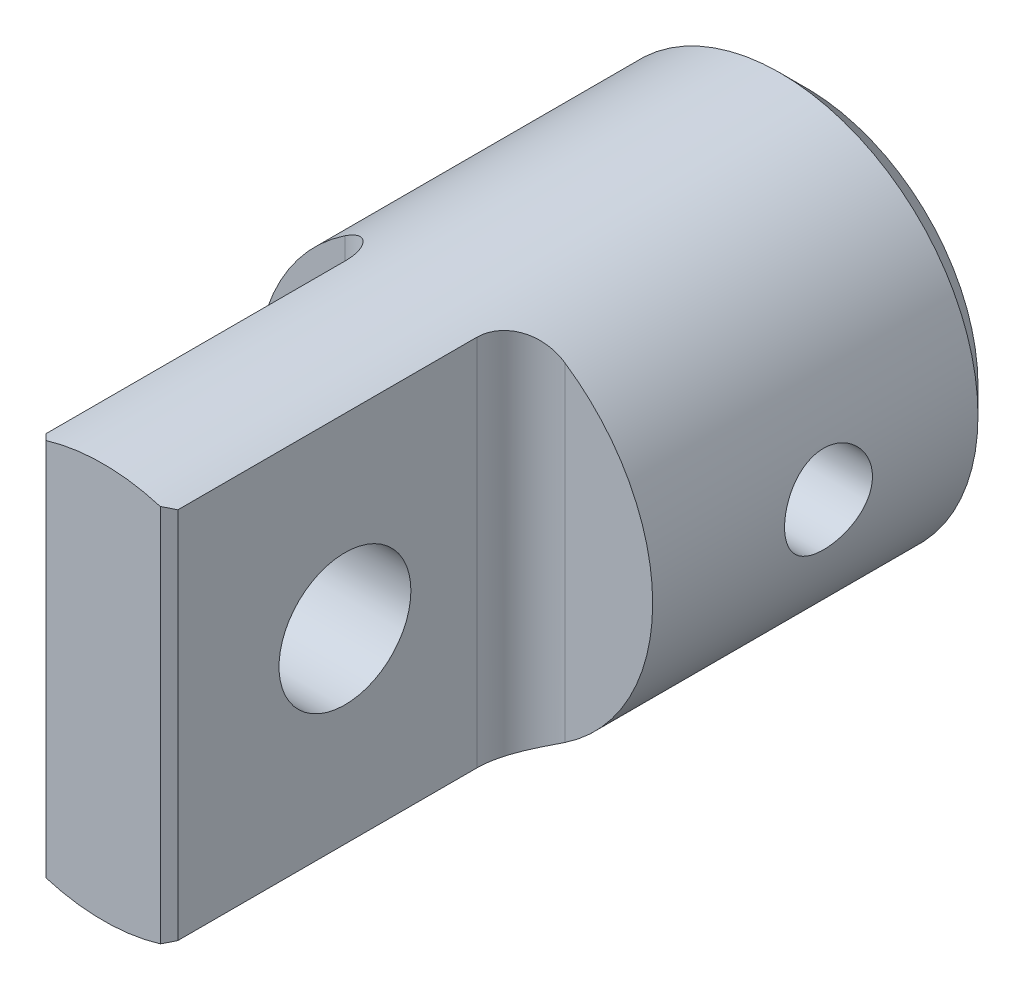
from build123d import *

# Parameters (mm, degrees)
SKETCH_1_R               = 22.5
EXTRUDE_1_DEPTH          = 80
CUT_EXTRUDE_START        = -40
CUT_EXTRUDE_1_DEPTH      = 40
FILLET_1_R               = 5
SKETCH_3_R               = 7.5
CUT_EXTRUDE_2_DEPTH      = 89.352985385
CHAMFER_2_SIZE           = 1
CHAMFER_3_SIZE           = 3
CUT_EXTRUDE_3_DEPTH      = 87.095876934
CUT_EXTRUDE_3_DEPTH_BACK = 87.095876934
SKETCH_4_R               = 5


with BuildPart() as part:
    # Эскиз1 → Бобышка-Вытянуть1 (new body)
    with BuildSketch(Plane.XY):
        Circle(SKETCH_1_R)
    extrude(amount=EXTRUDE_1_DEPTH)

    # Эскиз2 → Вырез-Вытянуть1 (cut)
    with BuildSketch(Plane.XY.offset(80).offset(CUT_EXTRUDE_START)):
        with BuildLine():
            Line((7.5, 21.213203436), (7.5, -21.213203436))
            ThreePointArc((7.5, -21.213203436), (22.5, 0), (7.5, 21.213203436))
        make_face()
        with BuildLine():
            Line((-7.5, 21.213203436), (-7.5, -21.213203436))
            ThreePointArc((-7.5, -21.213203436), (-22.5, 0), (-7.5, 21.213203436))
        make_face()
    extrude(amount=CUT_EXTRUDE_1_DEPTH, mode=Mode.SUBTRACT)

    # Скругление1
    fillet_1_edges = [part.edges().sort_by_distance(p)[0] for p in [
        (-7.5, 0, 40),
        (7.5, 0, 40),
    ]]
    fillet(fillet_1_edges, radius=FILLET_1_R)

    # Эскиз3 → Вырез-Вытянуть2 (cut, through all)
    with BuildSketch(Plane(origin=(7.5, 0, 0), x_dir=(0, 0, -1), z_dir=(1, 0, 0))):
        with Locations((-60, 0)):
            Circle(SKETCH_3_R)
    extrude(amount=-CUT_EXTRUDE_2_DEPTH, mode=Mode.SUBTRACT)

    # Фаска2
    chamfer_2_edges = [part.edges().sort_by_distance(p)[0] for p in [
        (-7.5, 0, 80),
        (7.5, 0, 80),
    ]]
    chamfer(chamfer_2_edges, length=CHAMFER_2_SIZE)

    # Фаска3
    chamfer_3_edges = [part.edges().sort_by_distance(p)[0] for p in [
        (-22.5, 0, 0),
    ]]
    chamfer(chamfer_3_edges, length=CHAMFER_3_SIZE)

    # Эскиз4 → Вырез-Вытянуть3 (cut, two sides: drawn at the far end of the back side and taken through both)
    with BuildSketch(Plane(origin=(0, 0, 0), x_dir=(0, 0, -1), z_dir=(1, 0, 0)).offset(-CUT_EXTRUDE_3_DEPTH_BACK)):
        with Locations((-20, 0)):
            Circle(SKETCH_4_R)
    extrude(amount=CUT_EXTRUDE_3_DEPTH + CUT_EXTRUDE_3_DEPTH_BACK, mode=Mode.SUBTRACT)


solid = part.part
